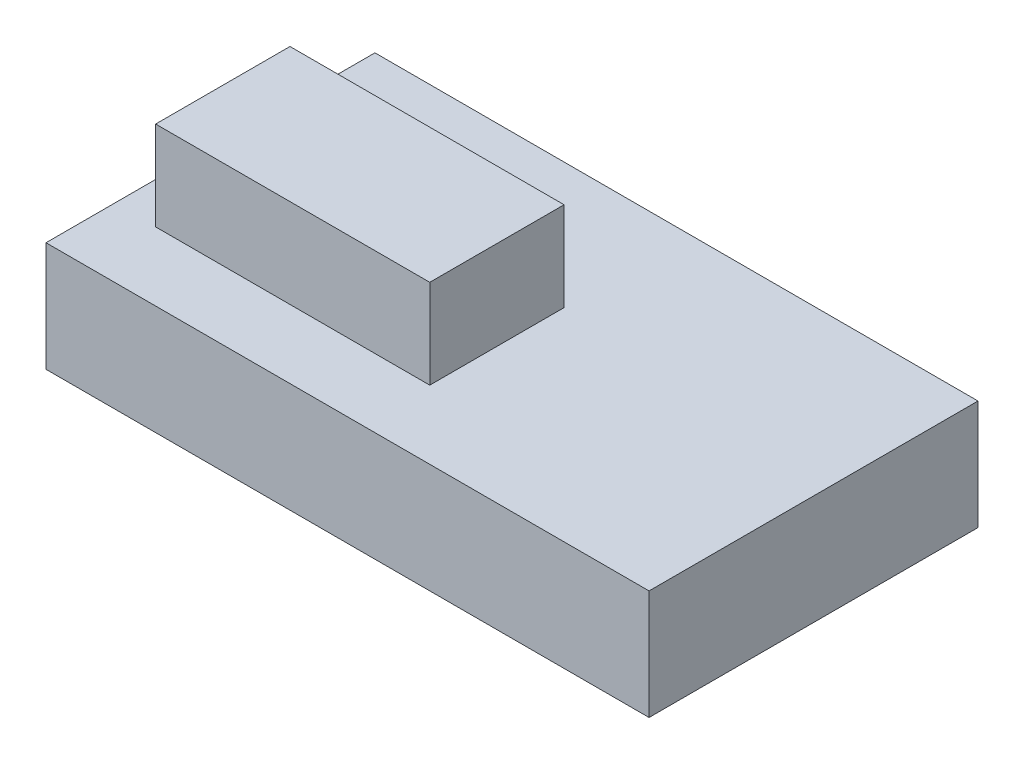
from build123d import *

# Parameters (mm, degrees)
SKETCH1_W           = 55.88
SKETCH1_H           = 30.48
BOSS_EXTRUDE1_DEPTH = 10.16
SKETCH2_W           = 25.4
SKETCH2_H           = 12.446
BOSS_EXTRUDE2_DEPTH = 8.255


with BuildPart() as part:
    # Sketch1 → Boss-Extrude1 (new body)
    with BuildSketch(Plane(origin=(0, 0, 0), x_dir=(1, 0, 0), z_dir=(0, 1, 0))):
        with Locations((-27.94, 15.24)):
            Rectangle(SKETCH1_W, SKETCH1_H)
    extrude(amount=BOSS_EXTRUDE1_DEPTH)

    # Sketch2 → Boss-Extrude2 (add)
    with BuildSketch(Plane(origin=(0, 10.16, 0), x_dir=(1, 0, 0), z_dir=(0, 1, 0))):
        with Locations((-39.37, 12.573)):
            Rectangle(SKETCH2_W, SKETCH2_H)
    extrude(amount=BOSS_EXTRUDE2_DEPTH)


solid = part.part
